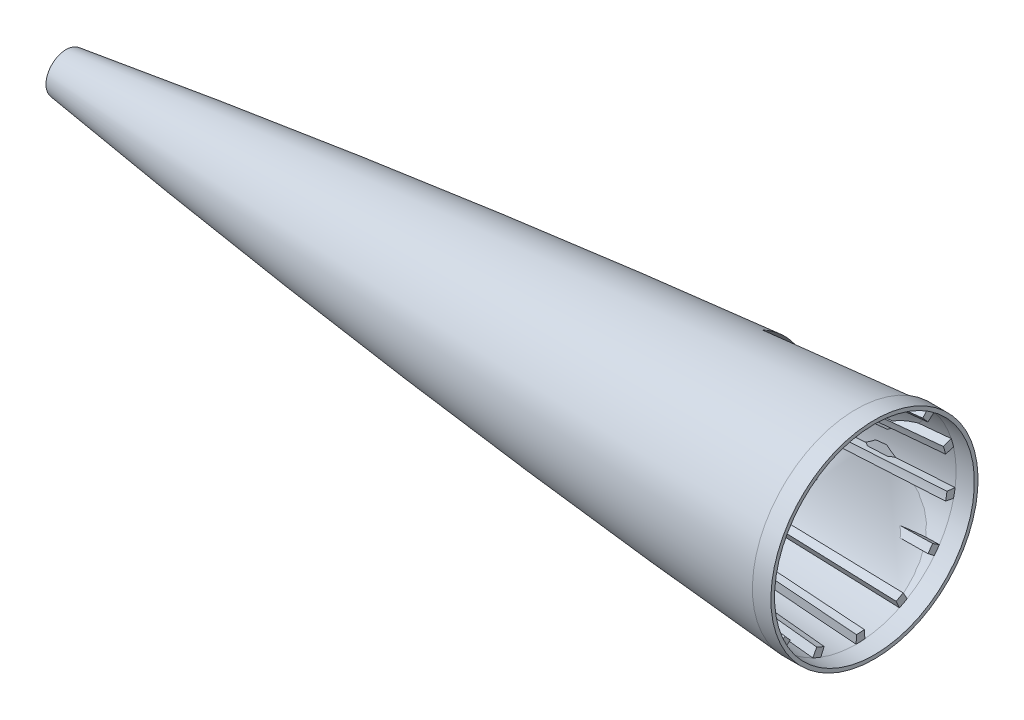
from build123d import *

# Parameters (mm, degrees)
SKETCH14_W         = 15
SKETCH14_H         = 3
CUT_EXTRUDE3_DEPTH = 250
SKETCH20_R         = 3
CUT_EXTRUDE4_DEPTH = 250
REVOLVE7_ANGLE     = 5
CIRPATTERN2_COUNT  = 14


with BuildPart() as part:
    # Sketch1 → Revolve1 (revolve)
    with BuildSketch(Plane(origin=(0, 0, 0), x_dir=(-1, 0, 0), z_dir=(0, 0, -1)), mode=Mode.PRIVATE) as revolve1_sk:
        with BuildLine():
            Line((-763.382394472, 85), (-763.235294117, 85))
            ThreePointArc((-763.235294117, 85), (-380.825050597, 49.616912867), (0, 0))
            Line((0, 0), (-22.46527886, 0))
            Line((-22.46527886, 0), (-22.46527886, 0.296477795))
            ThreePointArc((-22.46527886, 0.296477795), (-392.16587196, 47.855375712), (-763.345777049, 82))
            Line((-763.345777049, 82), (-763.382394472, 82))
            Line((-763.382394472, 82), (-763.382394472, 85))
        make_face()
    revolve(revolve1_sk.sketch.rotate(Axis((763.235294117, 0, 0), (-1, 0, 0)), 180), axis=Axis((763.235294117, 0, 0), (-1, 0, 0)))

    # Sketch14 → Revolve4 (revolve)
    with BuildSketch(Plane(origin=(0, 0, 0), x_dir=(-1, 0, 0), z_dir=(0, 0, -1)), mode=Mode.PRIVATE) as revolve4_sk:
        with Locations((-770.882394472, 83.5)):
            Rectangle(SKETCH14_W, SKETCH14_H)
    revolve(revolve4_sk.sketch.rotate(Axis((763.235294117, 0, 0), (1.0, 4.471170613520276e-12, -1.9795204121636835e-15)), 180), axis=Axis((763.235294117, 0, 0), (1.0, 4.471170613520276e-12, -1.9795204121636835e-15)))

    # Sketch18 → Cut-Extrude3 (cut, symmetric)
    with BuildSketch(Plane.XY):
        Polygon((-14.456340736, 18.501716749), (-14.456340736, -44.170271202), (115, -44.170271202), (115, 0), (115, 28.193165309), (-14.456340736, 28.193165309), align=None)
    extrude(amount=CUT_EXTRUDE3_DEPTH, both=True, mode=Mode.SUBTRACT)

    # Sketch19 → Revolve6 (revolve)
    with BuildSketch(Plane.XY, mode=Mode.PRIVATE) as revolve6_sk:
        Polygon((115, 16.506911496), (115, 0), (124.8, 0), (124.8, 17.505400014), align=None)
    revolve(revolve6_sk.sketch.rotate(Axis((115, 0, 0), (1, 0, 0)), 180), axis=Axis((115, 0, 0), (1, 0, 0)))

    # Sketch20 → Cut-Extrude4 (cut, symmetric)
    with BuildSketch(Plane.ZY.offset(-115)):
        Circle(SKETCH20_R)
    extrude(amount=CUT_EXTRUDE4_DEPTH, both=True, mode=Mode.SUBTRACT)

    # Sketch21 → Revolve7 (revolve)
    with BuildSketch(Plane.XY):
        with BuildLine():
            Line((763.235294117, 85), (763.603633258, 75))
            ThreePointArc((763.603633258, 75), (443.777305757, 46.376729418), (125, 7.78656595))
            Line((125, 7.78656595), (115, 7.044178147))
            Line((115, 7.044178147), (115, 16.506911496))
            ThreePointArc((115, 16.506911496), (438.575588607, 55.883629138), (763.235294117, 85))
        make_face()
    revolve7 = revolve(axis=Axis((115, 0, 0), (1, 0, 0)), revolution_arc=REVOLVE7_ANGLE)

    # CirPattern2: Revolve7 ×14 about axis
    cirpattern2_axis = Axis((0, 0, 0), (1, 0, 0))
    for i in range(1, CIRPATTERN2_COUNT):
        add(revolve7.rotate(cirpattern2_axis, i * 360 / CIRPATTERN2_COUNT))


solid = part.part
